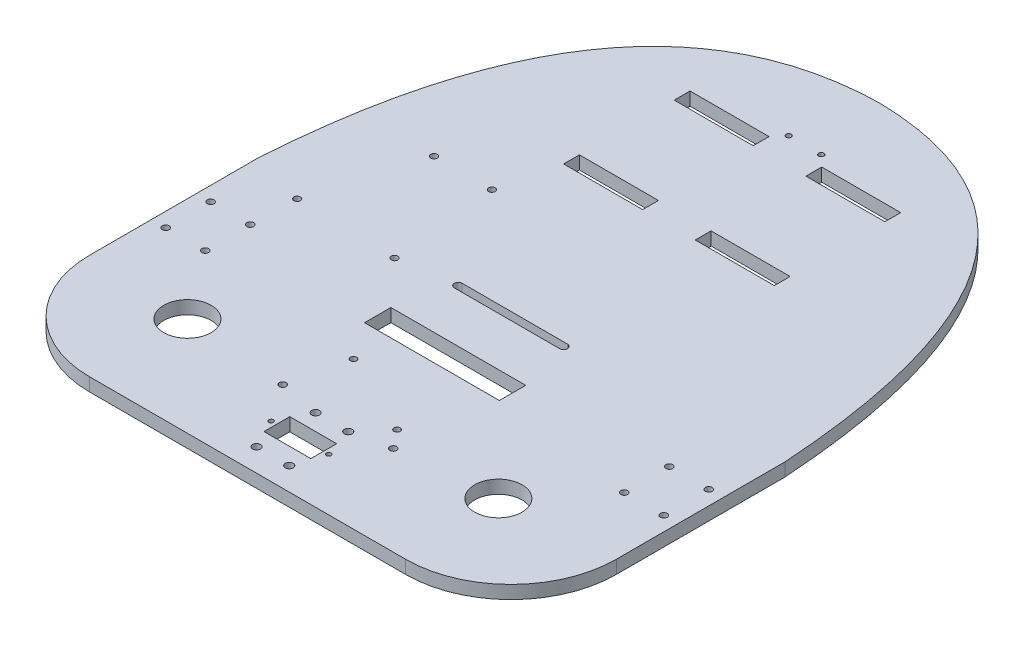
from build123d import *

# Parameters (mm, degrees)
BOSS_EXTRUDE1_DEPTH = 6.35
SKETCH2_R           = 1.27
CUT_EXTRUDE1_DEPTH  = 397.811495062
SKETCH5_R           = 1.27
CUT_EXTRUDE2_DEPTH  = 397.811495062
SKETCH6_W           = 38.1
SKETCH6_H           = 7.62
CUT_EXTRUDE5_DEPTH  = 397.811495062
CUT_EXTRUDE9_DEPTH  = 397.811495062
SKETCH15_W          = 22.606
SKETCH15_H          = 12.446
CUT_EXTRUDE12_DEPTH = 397.811495062
SKETCH17_R          = 1.1
CUT_EXTRUDE13_DEPTH = 343.418665957
SKETCH18_R          = 1.5875
SKETCH18_R_2        = 1.5
SKETCH18_R_3        = 1.651
CUT_EXTRUDE14_DEPTH = 343.36317383
SKETCH19_R          = 1.65
CUT_EXTRUDE15_DEPTH = 343.36317383
SKETCH20_R          = 11.43
CUT_EXTRUDE16_DEPTH = 397.811495062
SKETCH24_R          = 1.905
CUT_EXTRUDE20_DEPTH = 343.36317383


with BuildPart() as part:
    # Sketch1 → Boss-Extrude1 (new body)
    with BuildSketch(Plane(origin=(0, 0, 0), x_dir=(1, 0, 0), z_dir=(0, 1, 0))):
        with BuildLine():
            Line((-203.2, 0), (-50.8, 0))
            ThreePointArc((-50.8, 0), (-14.878975516, 14.878975516), (0, 50.8))
            Line((0, 50.8), (0, 132.097510542))
            add(Edge.make_bspline(
                [(0, 132.097510542), (-11.235039637, 303.015237559), (-127, 304.8)],
                knots=[0.173908828, 0.173908828, 0.173908828, 0.982925822, 0.982925822, 0.982925822], degree=2))
            add(Edge.make_bspline(
                [(-254, 132.097510542), (-242.764960363, 303.015237559), (-127, 304.8)],
                knots=[0.173908828, 0.173908828, 0.173908828, 0.982925822, 0.982925822, 0.982925822], degree=2))
            Line((-254, 132.097510542), (-254, 50.8))
            ThreePointArc((-254, 50.8), (-239.121024484, 14.878975516), (-203.2, 0))
        make_face()
    extrude(amount=BOSS_EXTRUDE1_DEPTH)

    # Sketch2 → Cut-Extrude1 (cut, through all)
    with BuildSketch(Plane(origin=(0, 6.35, 0), x_dir=(1, 0, 0), z_dir=(0, 1, 0))):
        with Locations(Location((-135.34380131, 269.24, 0), (0, 0, 270))):
            Circle(SKETCH2_R)
    extrude(amount=-CUT_EXTRUDE1_DEPTH, mode=Mode.SUBTRACT)

    # Sketch5 → Cut-Extrude2 (cut, through all)
    with BuildSketch(Plane(origin=(0, 6.35, 0), x_dir=(1, 0, 0), z_dir=(0, 1, 0))):
        with Locations(Location((-119.59580131, 269.24, 0), (0, 0, 270))):
            Circle(SKETCH5_R)
    extrude(amount=-CUT_EXTRUDE2_DEPTH, mode=Mode.SUBTRACT)

    # Sketch6 → Cut-Extrude5 (cut, through all)
    with BuildSketch(Plane(origin=(0, 6.35, 0), x_dir=(1, 0, 0), z_dir=(0, 1, 0))):
        with Locations((-158.75, 207.01)):
            Rectangle(SKETCH6_W, SKETCH6_H)
        with Locations((-158.75, 260.35)):
            Rectangle(SKETCH6_W, SKETCH6_H)
        with Locations((-95.25000011, 207.01)):
            Rectangle(SKETCH6_W, SKETCH6_H)
        with Locations((-95.25000011, 260.35)):
            Rectangle(SKETCH6_W, SKETCH6_H)
    extrude(amount=-CUT_EXTRUDE5_DEPTH, mode=Mode.SUBTRACT)

    # Sketch12 → Cut-Extrude9 (cut, through all)
    with BuildSketch(Plane(origin=(0, 6.35, 0), x_dir=(1, 0, 0), z_dir=(0, 1, 0))):
        with BuildLine():
            Line((-152.4, 125.095), (-101.6, 125.095))
            ThreePointArc((-101.6, 125.095), (-99.695, 127), (-101.6, 128.905))
            Line((-101.6, 128.905), (-152.4, 128.905))
            ThreePointArc((-152.4, 128.905), (-154.305, 127), (-152.4, 125.095))
        make_face()
        Polygon((-159.512, 101.6), (-159.512, 88.9), (-145.203610871, 88.9), (-94.5, 88.9), (-94.5, 101.6), align=None)
    extrude(amount=-CUT_EXTRUDE9_DEPTH, mode=Mode.SUBTRACT)

    # Sketch15 → Cut-Extrude12 (cut, through all)
    with BuildSketch(Plane(origin=(0, 6.35, 0), x_dir=(1, 0, 0), z_dir=(0, 1, 0))):
        with Locations((-127.000000055, 25.4)):
            Rectangle(SKETCH15_W, SKETCH15_H)
    extrude(amount=-CUT_EXTRUDE12_DEPTH, mode=Mode.SUBTRACT)

    # Sketch17 → Cut-Extrude13 (cut, through all)
    with BuildSketch(Plane(origin=(-70.897607534, -2.5, -15.584277619), x_dir=(1, 0, 0), z_dir=(0, -1, 0))):
        with Locations(Location((-70.055392521, -9.692722381, 0), (0, 0, 270))):
            Circle(SKETCH17_R)
        with Locations(Location((-42.255392521, -9.692722381, 0), (0, 0, 90))):
            Circle(SKETCH17_R)
    extrude(amount=-CUT_EXTRUDE13_DEPTH, mode=Mode.SUBTRACT)

    # Sketch18 → Cut-Extrude14 (cut, through all)
    with BuildSketch(Plane(origin=(-70.897607534, 6.35, -15.584277619), x_dir=(1, 0, 0), z_dir=(0, -1, 0))):
        with Locations(Location((-108.366177987, -107.537321923, 0), (0, 0, 270))):
            Circle(SKETCH18_R)
        with Locations(Location((-156.626177987, -108.807321923, 0), (0, 0, 270))):
            Circle(SKETCH18_R)
        with Locations(Location((-141.386177987, -159.607321923, 0), (0, 0, 270))):
            Circle(SKETCH18_R)
        with Locations(Location((-113.446177987, -159.607321923, 0), (0, 0, 270))):
            Circle(SKETCH18_R)
        with Locations(Location((-36.13742283, -36.50630685, 0), (0, 0, 270))):
            Circle(SKETCH18_R_2)
        with Locations(Location((-76.13742283, -55.50630685, 0), (0, 0, 270))):
            Circle(SKETCH18_R_2)
        with Locations(Location((-82.468497304, -27.730722381, 0), (0, 0, 270))):
            Circle(SKETCH18_R_3)
        with Locations(Location((-29.128497304, -27.730722381, 0), (0, 0, 270))):
            Circle(SKETCH18_R_3)
    extrude(amount=CUT_EXTRUDE14_DEPTH, mode=Mode.SUBTRACT)

    # Sketch19 → Cut-Extrude15 (cut, through all)
    with BuildSketch(Plane(origin=(-70.897607534, 0, -15.584277619), x_dir=(1, 0, 0), z_dir=(0, -1, 0))):
        with Locations(Location((-176.212392466, -65.014477652, 0), (0, 0, 270))):
            Circle(SKETCH19_R)
        with Locations(Location((-157.162392466, -65.014477652, 0), (0, 0, 270))):
            Circle(SKETCH19_R)
        with Locations(Location((-176.212392466, -86.714477652, 0), (0, 0, 270))):
            Circle(SKETCH19_R)
        with Locations(Location((-157.162392466, -86.714477652, 0), (0, 0, 270))):
            Circle(SKETCH19_R)
        with Locations(Location((64.007607534, -86.714477652, 0), (0, 0, 270))):
            Circle(SKETCH19_R)
        with Locations(Location((44.957607534, -86.714477652, 0), (0, 0, 270))):
            Circle(SKETCH19_R)
        with Locations(Location((44.957607534, -65.014477652, 0), (0, 0, 270))):
            Circle(SKETCH19_R)
        with Locations(Location((64.007607534, -65.014477652, 0), (0, 0, 270))):
            Circle(SKETCH19_R)
    extrude(amount=-CUT_EXTRUDE15_DEPTH, mode=Mode.SUBTRACT)

    # Sketch20 → Cut-Extrude16 (cut, through all)
    with BuildSketch(Plane(origin=(0, 6.35, 0), x_dir=(1, 0, 0), z_dir=(0, 1, 0))):
        with Locations(Location((-53.826154214, 47.757613525, 0), (0, 0, 270))):
            Circle(SKETCH20_R)
        with Locations(Location((-203.77940498, 47.757613525, 0), (0, 0, 270))):
            Circle(SKETCH20_R)
    extrude(amount=-CUT_EXTRUDE16_DEPTH, mode=Mode.SUBTRACT)

    # Sketch24 → Cut-Extrude20 (cut, through all)
    with BuildSketch(Plane(origin=(-70.897607534, 0, -15.584277619), x_dir=(1, 0, 0), z_dir=(0, -1, 0))):
        with Locations(Location((-62.829392521, -23.916722381, 0), (0, 0, 270))):
            Circle(SKETCH24_R)
        with Locations(Location((-47.081392521, -23.916722381, 0), (0, 0, 270))):
            Circle(SKETCH24_R)
        with Locations(Location((-47.081392521, 4.531277619, 0), (0, 0, 270))):
            Circle(SKETCH24_R)
        with Locations(Location((-62.829392521, 4.531277619, 0), (0, 0, 270))):
            Circle(SKETCH24_R)
    extrude(amount=-CUT_EXTRUDE20_DEPTH, mode=Mode.SUBTRACT)


solid = part.part
